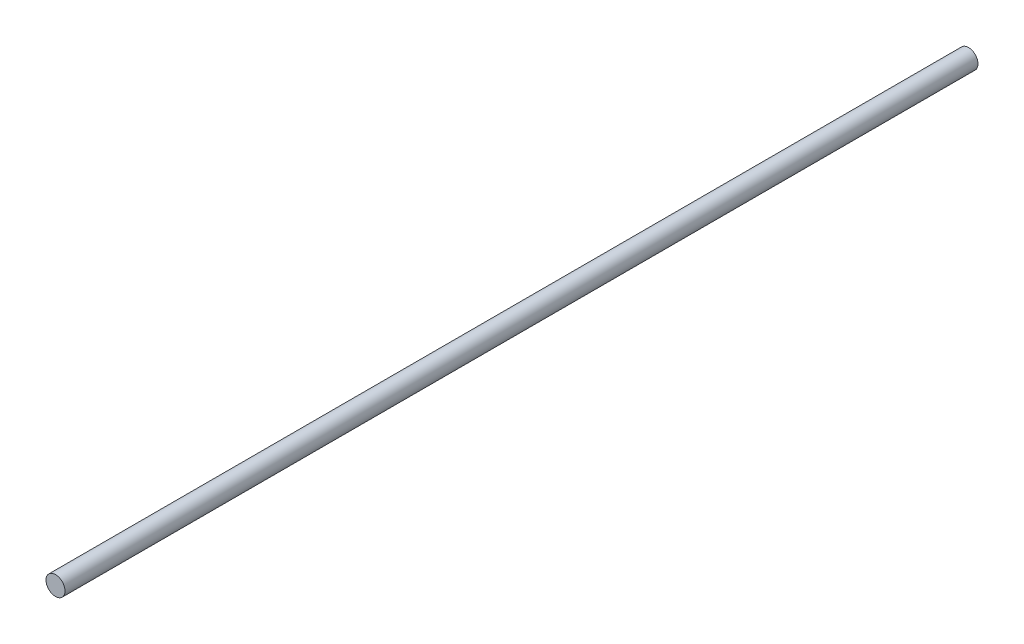
from build123d import *

# Parameters (mm, degrees)
BOSS_EXTRUDE1_DEPTH      = 152.4
BOSS_EXTRUDE1_DEPTH_BACK = 152.4
SKETCH3_R                = 3.175


with BuildPart() as part:
    # Sketch3 → Boss-Extrude1 (new, two sides: drawn at the far end of the back side and taken through both)
    with BuildSketch(Plane.XY.offset(-BOSS_EXTRUDE1_DEPTH_BACK)):
        Circle(SKETCH3_R)
    extrude(amount=BOSS_EXTRUDE1_DEPTH + BOSS_EXTRUDE1_DEPTH_BACK)


solid = part.part
